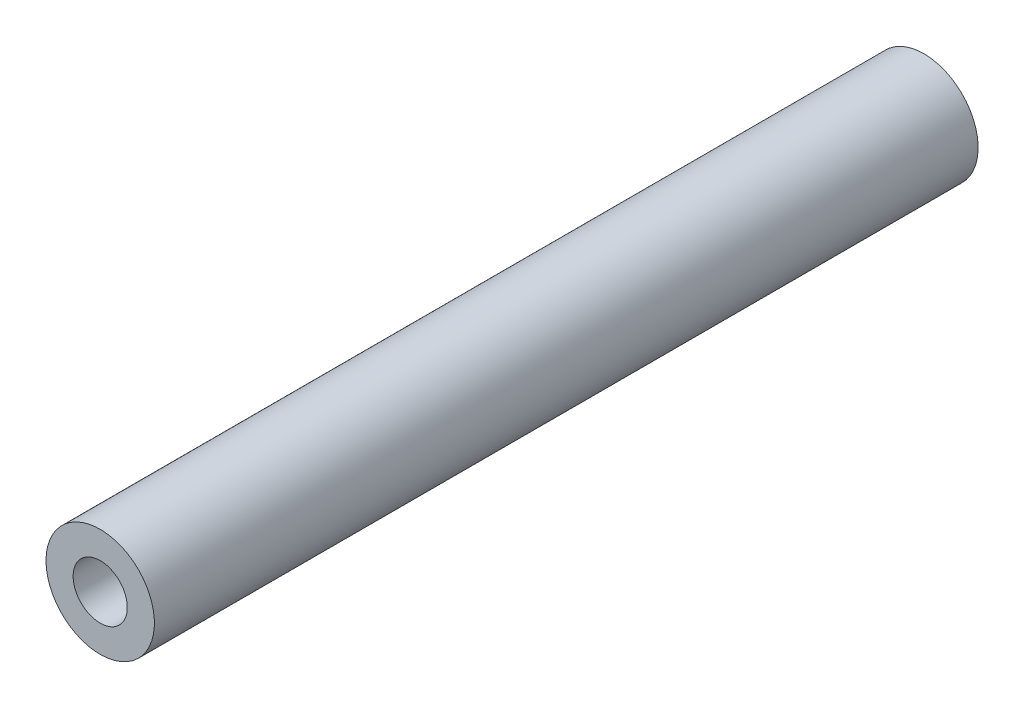
from build123d import *

# Parameters (mm, degrees)
SKETCH1_R           = 6.35
SKETCH1_R_2         = 3.175
BOSS_EXTRUDE1_DEPTH = 96.52


with BuildPart() as part:
    # Sketch1 → Boss-Extrude1 (new body)
    with BuildSketch(Plane.XY):
        with Locations(Location((0, 0, 0), (0, 0, 180))):
            Circle(SKETCH1_R)
        with Locations(Location((0, 0, 0), (0, 0, 180))):
            Circle(SKETCH1_R_2, mode=Mode.SUBTRACT)
    extrude(amount=BOSS_EXTRUDE1_DEPTH)


solid = part.part
